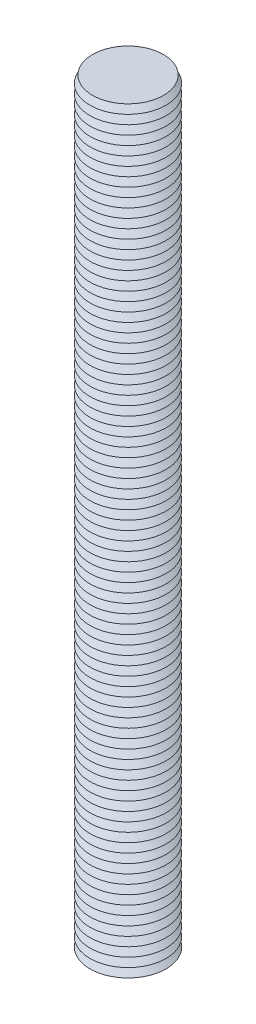
from build123d import *


with BuildPart() as part:
    # 草图1 → 旋转1 (revolve)
    with BuildSketch(Plane.XY, mode=Mode.PRIVATE) as revolve_1_sk:
        Polygon((0, 0), (0, 80), (3.734101374, 80), (3.3, 79.705779012), (4, 79.231339851), (3.3, 78.756900691), (4, 78.28246153), (3.3, 77.808022369), (4, 77.333583208), (3.3, 76.859144047), (4, 76.384704887), (3.3, 75.910265726), (4, 75.435826565), (3.3, 74.961387404), (4, 74.486948243), (3.3, 74.012509083), (4, 73.538069922), (3.3, 73.063630761), (4, 72.5891916), (3.3, 72.11475244), (4, 71.640313279), (3.3, 71.165874118), (4, 70.691434957), (3.3, 70.216995796), (4, 69.742556636), (3.3, 69.268117475), (4, 68.793678314), (3.3, 68.319239153), (4, 67.844799992), (3.3, 67.370360832), (4, 66.895921671), (3.3, 66.42148251), (4, 65.947043349), (3.3, 65.472604189), (4, 64.998165028), (3.3, 64.523725867), (4, 64.049286706), (3.3, 63.574847545), (4, 63.100408385), (3.3, 62.625969224), (4, 62.151530063), (3.3, 61.677090902), (4, 61.202651741), (3.3, 60.728212581), (4, 60.25377342), (3.3, 59.779334259), (4, 59.304895098), (3.3, 58.830455937), (4, 58.356016777), (3.3, 57.881577616), (4, 57.407138455), (3.3, 56.932699294), (4, 56.458260134), (3.3, 55.983820973), (4, 55.509381812), (3.3, 55.034942651), (4, 54.56050349), (3.3, 54.08606433), (4, 53.611625169), (3.3, 53.137186008), (4, 52.662746847), (3.3, 52.188307686), (4, 51.713868526), (3.3, 51.239429365), (4, 50.764990204), (3.3, 50.290551043), (4, 49.816111883), (3.3, 49.341672722), (4, 48.867233561), (3.3, 48.3927944), (4, 47.918355239), (3.3, 47.443916079), (4, 46.969476918), (3.3, 46.495037757), (4, 46.020598596), (3.3, 45.546159435), (4, 45.071720275), (3.3, 44.597281114), (4, 44.122841953), (3.3, 43.648402792), (4, 43.173963632), (3.3, 42.699524471), (4, 42.22508531), (3.3, 41.750646149), (4, 41.276206988), (3.3, 40.801767828), (4, 40.327328667), (3.3, 39.852889506), (4, 39.378450345), (3.3, 38.904011184), (4, 38.429572024), (3.3, 37.955132863), (4, 37.480693702), (3.3, 37.006254541), (4, 36.531815381), (3.3, 36.05737622), (4, 35.582937059), (3.3, 35.108497898), (4, 34.634058737), (3.3, 34.159619577), (4, 33.685180416), (3.3, 33.210741255), (4, 32.736302094), (3.3, 32.261862933), (4, 31.787423773), (3.3, 31.312984612), (4, 30.838545451), (3.3, 30.36410629), (4, 29.88966713), (3.3, 29.415227969), (4, 28.940788808), (3.3, 28.466349647), (4, 27.991910486), (3.3, 27.517471326), (4, 27.043032165), (3.3, 26.568593004), (4, 26.094153843), (3.3, 25.619714682), (4, 25.145275522), (3.3, 24.670836361), (4, 24.1963972), (3.3, 23.721958039), (4, 23.247518879), (3.3, 22.773079718), (4, 22.298640557), (3.3, 21.824201396), (4, 21.349762235), (3.3, 20.875323075), (4, 20.400883914), (3.3, 19.926444753), (4, 19.452005592), (3.3, 18.977566431), (4, 18.503127271), (3.3, 18.02868811), (4, 17.554248949), (3.3, 17.079809788), (4, 16.605370628), (3.3, 16.130931467), (4, 15.656492306), (3.3, 15.182053145), (4, 14.707613984), (3.3, 14.233174824), (4, 13.758735663), (3.3, 13.284296502), (4, 12.809857341), (3.3, 12.33541818), (4, 11.86097902), (3.3, 11.386539859), (4, 10.912100698), (3.3, 10.437661537), (4, 9.963222377), (3.3, 9.488783216), (4, 9.014344055), (3.3, 8.539904894), (4, 8.065465733), (3.3, 7.591026573), (4, 7.116587412), (3.3, 6.642148251), (4, 6.16770909), (3.3, 5.693269929), (4, 5.218830769), (3.3, 4.744391608), (4, 4.269952447), (3.3, 3.795513286), (4, 3.321074126), (3.3, 2.846634965), (4, 2.372195804), (3.3, 1.897756643), (4, 1.423317482), (3.3, 0.948878322), (4, 0.474439161), (3.3, 0), align=None)
    revolve(revolve_1_sk.sketch.rotate(Axis((0, 0, 0), (0, 1, 0)), 90), axis=Axis((0, 0, 0), (0, 1, 0)))


solid = part.part
